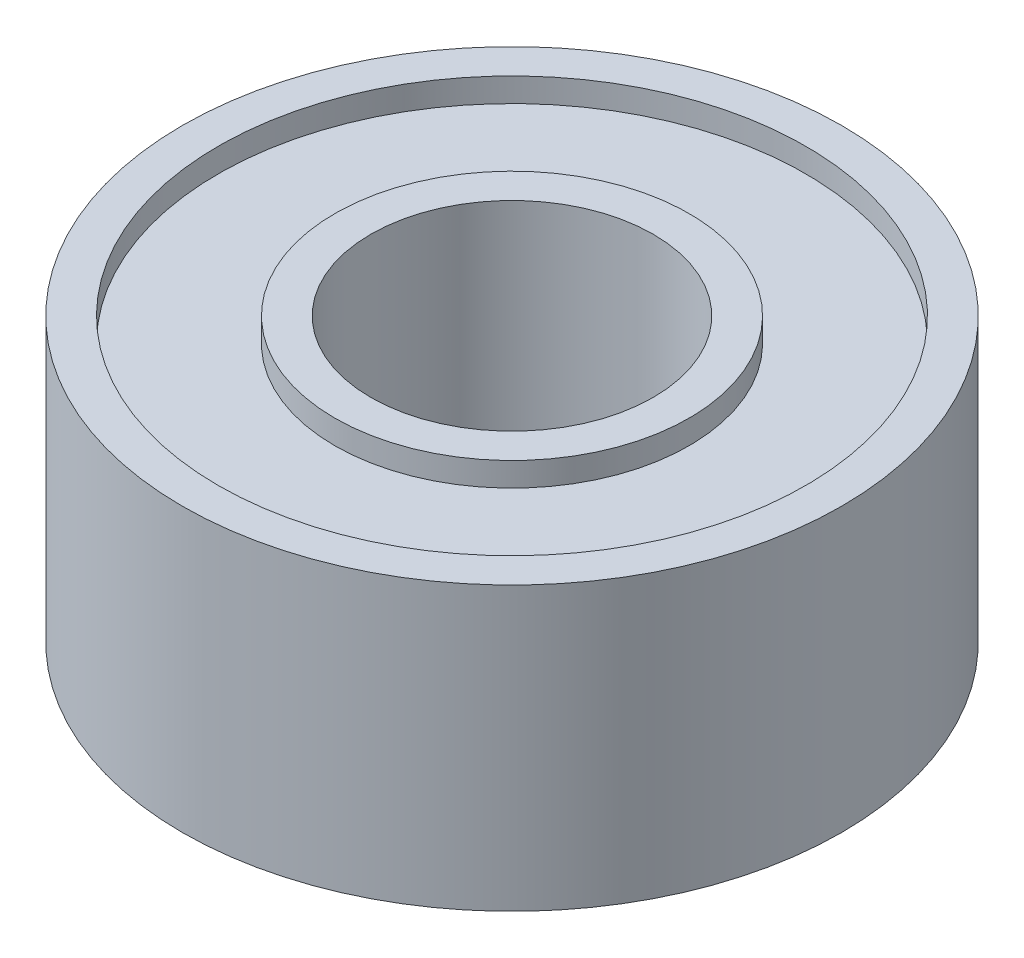
from build123d import *

# Parameters (mm, degrees)
SKETCH1_R           = 3.5
SKETCH1_R_2         = 1.5
BOSS_EXTRUDE1_DEPTH = 1.5
SKETCH2_R           = 3.119
SKETCH2_R_2         = 1.881
CUT_EXTRUDE1_DEPTH  = 0.254


with BuildPart() as part:
    # Sketch1 → Boss-Extrude1 (new, symmetric)
    with BuildSketch(Plane(origin=(0, 0, 0), x_dir=(1, 0, 0), z_dir=(0, 1, 0))):
        with Locations(Location((0, 0, 0), (0, 0, 270))):
            Circle(SKETCH1_R)
        with Locations(Location((0, 0, 0), (0, 0, 270))):
            Circle(SKETCH1_R_2, mode=Mode.SUBTRACT)
    extrude(amount=BOSS_EXTRUDE1_DEPTH, both=True)

    # Sketch2 → Cut-Extrude1 (cut)
    with BuildSketch(Plane(origin=(0, 1.5, 0), x_dir=(1, 0, 0), z_dir=(0, 1, 0))):
        with Locations(Location((0, 0, 0), (0, 0, 270))):
            Circle(SKETCH2_R)
        with Locations(Location((0, 0, 0), (0, 0, 270))):
            Circle(SKETCH2_R_2, mode=Mode.SUBTRACT)
    cut_extrude1 = extrude(amount=-CUT_EXTRUDE1_DEPTH, mode=Mode.SUBTRACT)

    # Mirror1: Cut-Extrude1 across plane
    add(cut_extrude1.mirror(Plane.ZX), mode=Mode.SUBTRACT)


solid = part.part
